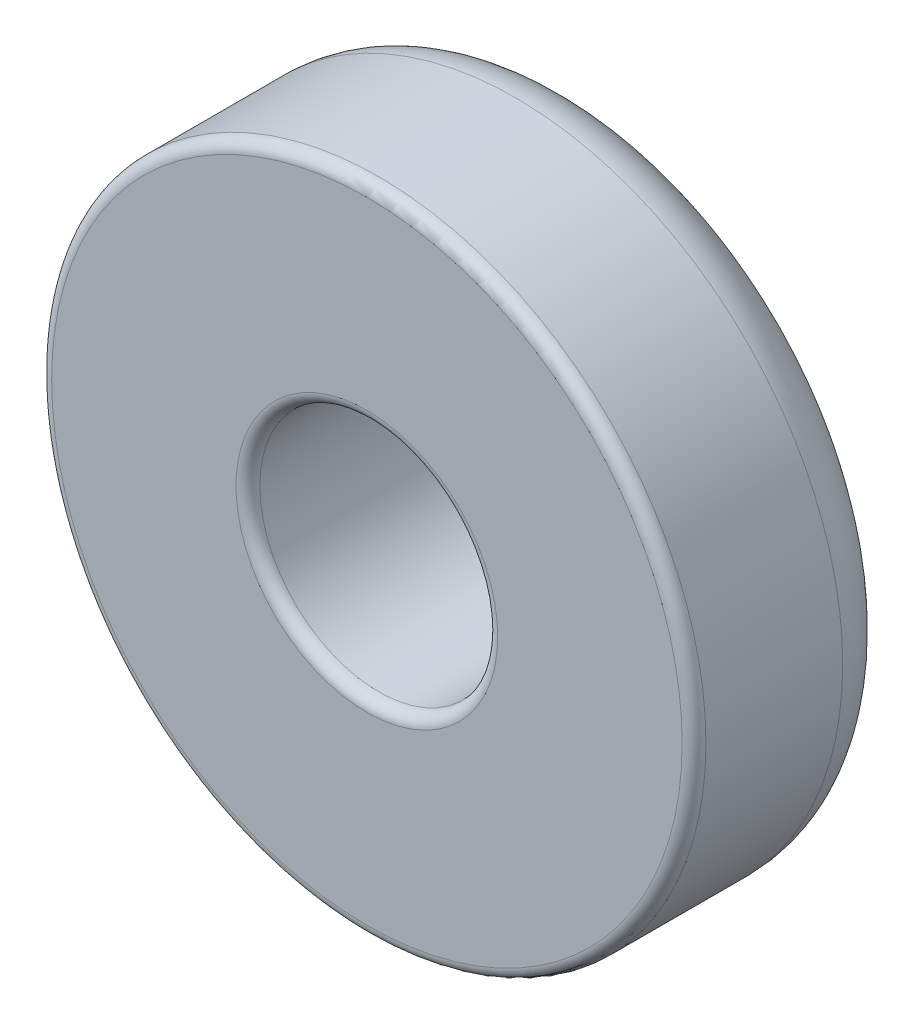
from build123d import *

# Parameters (mm, degrees)
SKETCH1_R           = 2.75
SKETCH1_R_2         = 1
EXTRUDE_THIN1_DEPTH = 1.75
FILLET1_R           = 0.5
FILLET2_R           = 0.1


with BuildPart() as part:
    # Sketch1 → Extrude-Thin1 (new body)
    with BuildSketch(Plane.XY):
        Circle(SKETCH1_R)
        Circle(SKETCH1_R_2, mode=Mode.SUBTRACT)
    extrude(amount=EXTRUDE_THIN1_DEPTH)

    # Fillet1
    fillet1_edges = [part.edges().sort_by_distance(p)[0] for p in [
        (-2.75, 0, 0),
    ]]
    fillet(fillet1_edges, radius=FILLET1_R)

    # Fillet2
    fillet2_edges = [part.edges().sort_by_distance(p)[0] for p in [
        (-2.75, 0, 1.75),
        (-1, 0, 0),
        (-1, 0, 1.75),
    ]]
    fillet(fillet2_edges, radius=FILLET2_R)


solid = part.part
